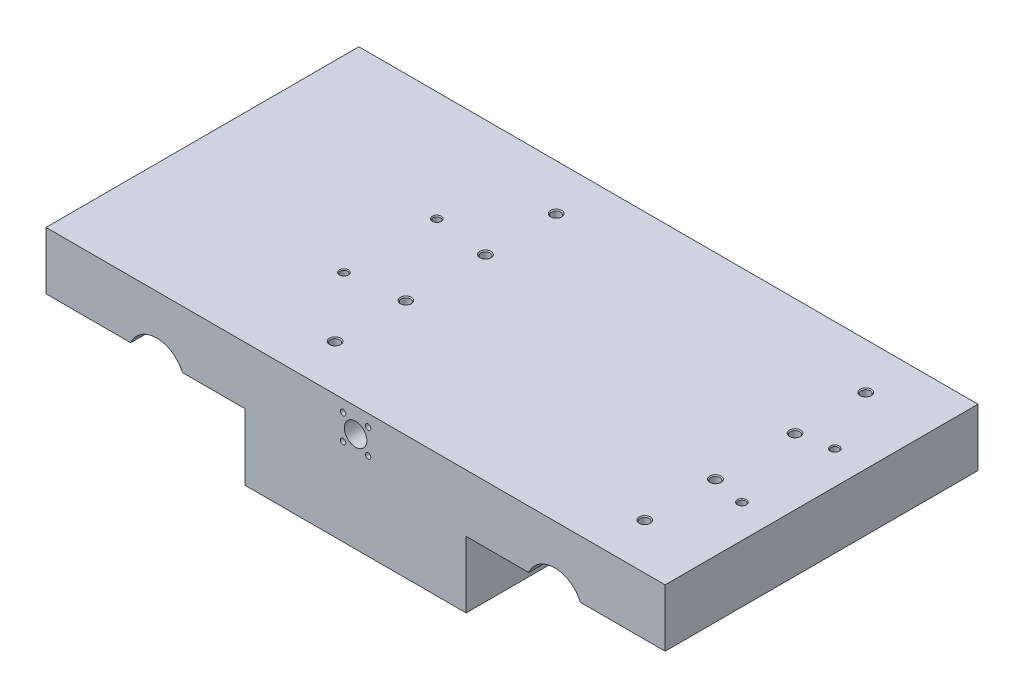
from build123d import *

# Parameters (mm, degrees)
SKETCH1_R                          = 5.1
BOSS_EXTRUDE1_DEPTH                = 70.75
FURO_ROSCADO_DE_M5X0_81_AT_2_COUNT = 2
FURO_ROSCADO_DE_M5X0_81_AT_2_PITCH = 32
M3X0_5_TAPPED_HOLE1_AT_2_COUNT     = 2
M3X0_5_TAPPED_HOLE1_AT_2_PITCH     = 11.313708499
M3X0_5_TAPPED_HOLE1_AT_3_COUNT     = 2
M3X0_5_TAPPED_HOLE1_AT_3_PITCH     = 11.313708499
M3X0_5_TAPPED_HOLE1_AT_4_COUNT     = 2
M3X0_5_TAPPED_HOLE1_AT_4_PITCH     = 16
FURO_ROSCADO_DE_M4X0_71_AT_2_COUNT = 2
FURO_ROSCADO_DE_M4X0_71_AT_2_PITCH = 42
PADR_O_LINEAR1_COUNT               = 2
PADR_O_LINEAR1_PITCH               = 180
SKETCH5_W                          = 100
SKETCH5_H                          = 30
BOSS_EXTRUDE2_DEPTH                = 141.5
LPATTERN1_COUNT                    = 2
LPATTERN1_PITCH                    = 140


with BuildPart() as part:
    # Sketch1 → Boss-Extrude1 (new, symmetric)
    with BuildSketch(Plane.XY):
        with BuildLine():
            Line((-140, 0), (-140, 26))
            Line((-140, 26), (140, 26))
            Line((140, 26), (140, 0))
            Line((140, 0), (101.674330816, 0))
            ThreePointArc((101.674330816, 0), (90, 7.7), (78.325669184, 0))
            Line((78.325669184, 0), (-78.325669184, 0))
            ThreePointArc((-78.325669184, 0), (-90, 7.7), (-101.674330816, 0))
            Line((-101.674330816, 0), (-140, 0))
        make_face()
        with Locations((0, 15)):
            Circle(SKETCH1_R, mode=Mode.SUBTRACT)
    extrude(amount=BOSS_EXTRUDE1_DEPTH, both=True)

    # Esboço3 → Furo roscado de M5x0.81 (revolve, cut)
    with BuildSketch(Plane(origin=(110, 26, -50), x_dir=(0, 0, 1), z_dir=(1, 0, 0))):
        Polygon((0, 0), (0, 15.2618073), (2.1, 14), (2.1, 0.425), (2.525, 0), align=None)
    furo_roscado_de_m5x0_81 = revolve(axis=Axis((110, 32.35, -50), (0, -1, 0)), mode=Mode.SUBTRACT)

    # Furo roscado de M5x0.81 at 2: Furo roscado de M5x0.81 ×2
    with Locations(*[(0, 0, i * FURO_ROSCADO_DE_M5X0_81_AT_2_PITCH) for i in range(1, FURO_ROSCADO_DE_M5X0_81_AT_2_COUNT)]):
        add(furo_roscado_de_m5x0_81, mode=Mode.SUBTRACT)

    # Sketch4 → M3x0.5 Tapped Hole1 (revolve, cut)
    with BuildSketch(Plane(origin=(-5.656854249, 20.656854249, 70.75), x_dir=(0, -1, 0), z_dir=(1, 0, 0))):
        Polygon((0, 0), (0, 13.251075774), (1.25, 12.5), (1.25, 0), align=None)
    m3x0_5_tapped_hole1 = revolve(axis=Axis((-5.656854249, 20.656854249, 77.1), (0, 0, -1)), mode=Mode.SUBTRACT)

    # M3x0.5 Tapped Hole1 at 2: M3x0.5 Tapped Hole1 ×2
    with Locations(*[(i * M3X0_5_TAPPED_HOLE1_AT_2_PITCH, 0, 0) for i in range(1, M3X0_5_TAPPED_HOLE1_AT_2_COUNT)]):
        add(m3x0_5_tapped_hole1, mode=Mode.SUBTRACT)

    # M3x0.5 Tapped Hole1 at 3: M3x0.5 Tapped Hole1 ×2
    with Locations(*[(0, -i * M3X0_5_TAPPED_HOLE1_AT_3_PITCH, 0) for i in range(1, M3X0_5_TAPPED_HOLE1_AT_3_COUNT)]):
        add(m3x0_5_tapped_hole1, mode=Mode.SUBTRACT)

    # M3x0.5 Tapped Hole1 at 4: M3x0.5 Tapped Hole1 ×2
    with Locations(*[Vector(0.7071067811865596, -0.7071067811865357, 0) * (i * M3X0_5_TAPPED_HOLE1_AT_4_PITCH) for i in range(1, M3X0_5_TAPPED_HOLE1_AT_4_COUNT)]):
        add(m3x0_5_tapped_hole1, mode=Mode.SUBTRACT)

    # Mirror2: M3x0.5 Tapped Hole1 across plane
    add(m3x0_5_tapped_hole1.mirror(Plane.XY), mode=Mode.SUBTRACT)

    # Mirror2 copy 1 sketch → Mirror2 copy 1 (revolve, cut)
    with BuildSketch(Plane(origin=(5.656854249, 20.656854249, -70.75), x_dir=(0, -1, 0), z_dir=(1, 0, 0))):
        Polygon((0, 0), (0, -13.251075774), (1.25, -12.5), (1.25, 0), align=None)
    revolve(axis=Axis((5.656854249, 20.656854249, -77.1), (0, 0, -1)), mode=Mode.SUBTRACT)

    # Mirror2 copy 2 sketch → Mirror2 copy 2 (revolve, cut)
    with BuildSketch(Plane(origin=(-5.656854249, 9.343145751, -70.75), x_dir=(0, -1, 0), z_dir=(1, 0, 0))):
        Polygon((0, 0), (0, -13.251075774), (1.25, -12.5), (1.25, 0), align=None)
    revolve(axis=Axis((-5.656854249, 9.343145751, -77.1), (0, 0, -1)), mode=Mode.SUBTRACT)

    # Mirror2 copy 3 sketch → Mirror2 copy 3 (revolve, cut)
    with BuildSketch(Plane(origin=(5.656854249, 9.343145751, -70.75), x_dir=(0, -1, 0), z_dir=(1, 0, 0))):
        Polygon((0, 0), (0, -13.251075774), (1.25, -12.5), (1.25, 0), align=None)
    revolve(axis=Axis((5.656854249, 9.343145751, -77.1), (0, 0, -1)), mode=Mode.SUBTRACT)

    # Esboço7 → Furo roscado de M4x0.71 (revolve, cut)
    with BuildSketch(Plane(origin=(-55, 26, -21), x_dir=(0, 0, 1), z_dir=(1, 0, 0))):
        Polygon((0, 0), (0, 12.491420021), (1.65, 11.5), (1.65, 0.375), (2.025, 0), align=None)
    furo_roscado_de_m4x0_71 = revolve(axis=Axis((-55, 32.35, -21), (0, -1, 0)), mode=Mode.SUBTRACT)

    # Furo roscado de M4x0.71 at 2: Furo roscado de M4x0.71 ×2
    with Locations(*[(0, 0, i * FURO_ROSCADO_DE_M4X0_71_AT_2_PITCH) for i in range(1, FURO_ROSCADO_DE_M4X0_71_AT_2_COUNT)]):
        add(furo_roscado_de_m4x0_71, mode=Mode.SUBTRACT)

    # Padrão linear1: Furo roscado de M4x0.71 ×2
    with Locations(*[(i * PADR_O_LINEAR1_PITCH, 0, 0) for i in range(1, PADR_O_LINEAR1_COUNT)]):
        add(furo_roscado_de_m4x0_71, mode=Mode.SUBTRACT)

    # Padrão linear1 copy 1 sketch → Padrão linear1 copy 1 (revolve, cut)
    with BuildSketch(Plane(origin=(125, 26, 21), x_dir=(0, 0, 1), z_dir=(1, 0, 0))):
        Polygon((0, 0), (0, 12.491420021), (1.65, 11.5), (1.65, 0.375), (2.025, 0), align=None)
    revolve(axis=Axis((125, 32.35, 21), (0, -1, 0)), mode=Mode.SUBTRACT)

    # Sketch5 → Boss-Extrude2 (add)
    with BuildSketch(Plane.XY.offset(70.75)):
        with Locations((0, -15)):
            Rectangle(SKETCH5_W, SKETCH5_H)
    extrude(amount=-BOSS_EXTRUDE2_DEPTH)

    # LPattern1: Furo roscado de M5x0.81 ×2
    with Locations(*[(-i * LPATTERN1_PITCH, 0, 0) for i in range(1, LPATTERN1_COUNT)]):
        add(furo_roscado_de_m5x0_81, mode=Mode.SUBTRACT)

    # LPattern1 copy 1 sketch → LPattern1 copy 1 (revolve, cut)
    with BuildSketch(Plane(origin=(-30, 26, -18), x_dir=(0, 0, 1), z_dir=(1, 0, 0))):
        Polygon((0, 0), (0, 15.2618073), (2.1, 14), (2.1, 0.425), (2.525, 0), align=None)
    revolve(axis=Axis((-30, 32.35, -18), (0, -1, 0)), mode=Mode.SUBTRACT)

    # Mirror3: Furo roscado de M5x0.81 across plane
    add(furo_roscado_de_m5x0_81.mirror(Plane.XY), mode=Mode.SUBTRACT)

    # Mirror3 copy 1 sketch → Mirror3 copy 1 (revolve, cut)
    with BuildSketch(Plane(origin=(110, 26, 18), x_dir=(0, 0, -1), z_dir=(1, 0, 0))):
        Polygon((0, 0), (0, -15.2618073), (2.1, -14), (2.1, -0.425), (2.525, 0), align=None)
    revolve(axis=Axis((110, 32.35, 18), (0, 1, 0)), mode=Mode.SUBTRACT)

    # Mirror3 copy 2 sketch → Mirror3 copy 2 (revolve, cut)
    with BuildSketch(Plane(origin=(-30, 26, 50), x_dir=(0, 0, -1), z_dir=(1, 0, 0))):
        Polygon((0, 0), (0, -15.2618073), (2.1, -14), (2.1, -0.425), (2.525, 0), align=None)
    revolve(axis=Axis((-30, 32.35, 50), (0, 1, 0)), mode=Mode.SUBTRACT)

    # Mirror3 copy 3 sketch → Mirror3 copy 3 (revolve, cut)
    with BuildSketch(Plane(origin=(-30, 26, 18), x_dir=(0, 0, -1), z_dir=(1, 0, 0))):
        Polygon((0, 0), (0, -15.2618073), (2.1, -14), (2.1, -0.425), (2.525, 0), align=None)
    revolve(axis=Axis((-30, 32.35, 18), (0, 1, 0)), mode=Mode.SUBTRACT)


solid = part.part
